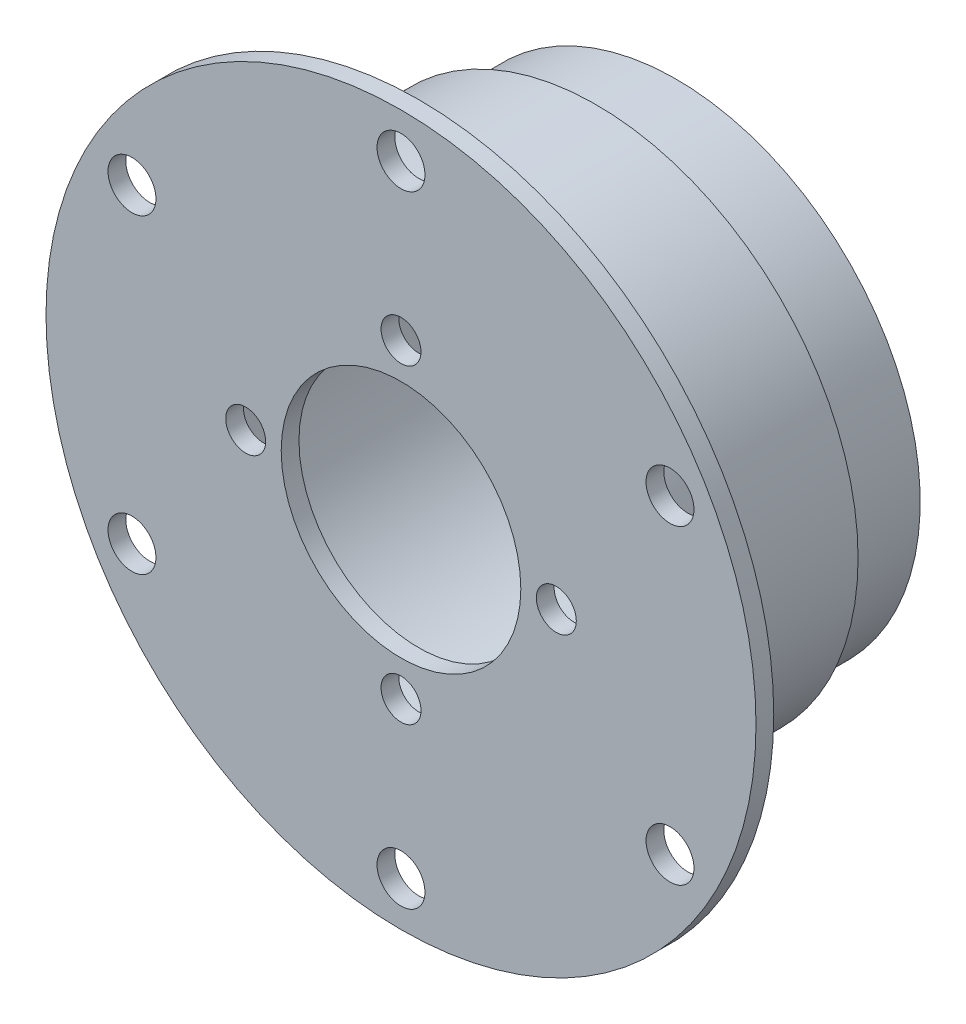
from build123d import *

# Parameters (mm, degrees)
SKETCH_1_R              = 40
SKETCH_1_R_2            = 13.5
EXTRUDE_1_DEPTH         = 2
HOLE_WIZARD_M4_1_D      = 4.5
HOLE_WIZARD_5_4_5_4_1_D = 5.4
SKETCH_8_R              = 29.5
SKETCH_8_R_2            = 21.5
EXTRUDE_2_DEPTH         = 29
CUT_EXTRUDE_START       = -9
SKETCH_10_R             = 29.5
SKETCH_10_R_2           = 27.5
CUT_EXTRUDE_2_DEPTH     = 9
HOLE_WIZARD_M3_1_D      = 2.5
HOLE_WIZARD_M3_1_DEPTH  = 8.5
HOLE_WIZARD_M3_1_TIP    = 0.751075774


with BuildPart() as part:
    # 草图1 → 凸台-拉伸1 (new body)
    with BuildSketch(Plane.XY):
        Circle(SKETCH_1_R)
        Circle(SKETCH_1_R_2, mode=Mode.SUBTRACT)
    extrude(amount=EXTRUDE_1_DEPTH)

    # M4 间隙孔1 (through all)
    with Locations(Plane(origin=(-17.5, 0, 2), x_dir=(1, 0, 0), z_dir=(0, 0, 1))):
        with Locations((0, 0), (17.5, 17.5), (35, 0), (17.5, -17.5)):
            Hole(HOLE_WIZARD_M4_1_D / 2)

    # Ø5.4 (5.4) 直径孔1 (through all)
    with Locations(Plane(origin=(0, 0, 0), x_dir=(-1, 0, 0), z_dir=(0, 0, -1))):
        with Locations((-30.310889132, 17.5), (0, 35), (30.310889132, 17.5), (30.310889132, -17.5), (0, -35), (-30.310889132, -17.5)):
            Hole(HOLE_WIZARD_5_4_5_4_1_D / 2)

    # 草图8 → 凸台-拉伸2 (add)
    with BuildSketch(Plane(origin=(0, 0, 0), x_dir=(-1, 0, 0), z_dir=(0, 0, -1))):
        with Locations(Location((0, 0, 0), (0, 0, 180))):
            Circle(SKETCH_8_R)
        with Locations(Location((0, 0, 0), (0, 0, 180))):
            Circle(SKETCH_8_R_2, mode=Mode.SUBTRACT)
    extrude(amount=EXTRUDE_2_DEPTH)

    # 草图10 → 切除-拉伸2 (cut)
    with BuildSketch(Plane(origin=(0, 0, -29), x_dir=(-1, 0, 0), z_dir=(0, 0, -1)).offset(CUT_EXTRUDE_START)):
        with Locations(Location((0, 0, 0), (0, 0, 180))):
            Circle(SKETCH_10_R)
        Circle(SKETCH_10_R_2, mode=Mode.SUBTRACT)
    extrude(amount=CUT_EXTRUDE_2_DEPTH, mode=Mode.SUBTRACT)

    # M3 螺纹孔1
    with Locations(Plane(origin=(25, 0, -29), x_dir=(-1, 0, 0), z_dir=(0, 0, -1))):
        with Locations((0, 0), (25, 25), (50, 0), (25, -25)):
            Hole(HOLE_WIZARD_M3_1_D / 2, depth=HOLE_WIZARD_M3_1_DEPTH)
            with Locations((0, 0, -(HOLE_WIZARD_M3_1_DEPTH + HOLE_WIZARD_M3_1_TIP / 2))):  # 118° drill point
                Cone(0, HOLE_WIZARD_M3_1_D / 2, HOLE_WIZARD_M3_1_TIP, mode=Mode.SUBTRACT)


solid = part.part
